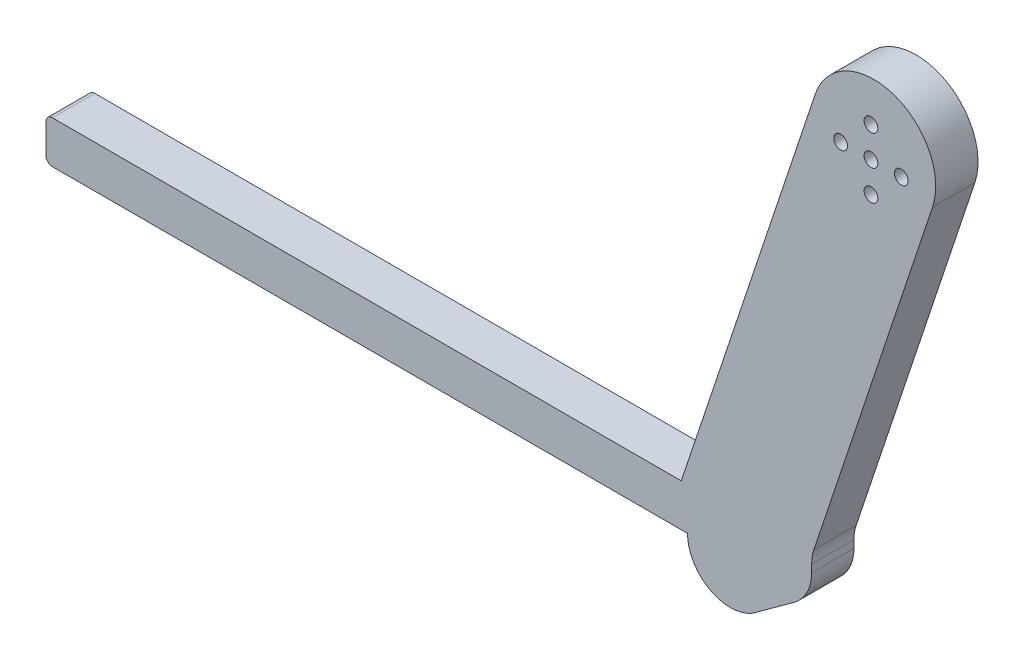
from build123d import *

# Parameters (mm, degrees)
EXTRUDE_1_DEPTH     = 10
SKETCH_1_15_R       = 1.62
CUT_EXTRUDE_2_DEPTH = 10
SKETCH_1_16_R       = 9.8
CUT_EXTRUDE_3_DEPTH = 2.2


with BuildPart() as part:
    # 草图1 → 凸台-拉伸1 (new body)
    with BuildSketch(Plane.XY):
        with BuildLine():
            Line((-150, -1.5), (-150, -8.5))
            ThreePointArc((-150, -8.5), (-149.560660172, -9.560660172), (-148.5, -10))
            Line((-148.5, -10), (1.474010293, -10))
            ThreePointArc((1.474010293, -10), (7.366779588, -19.192759664), (18.180300258, -17.676405182))
            Line((18.180300258, -17.676405182), (26.670550932, -11.495316766))
            ThreePointArc((26.670550932, -11.495316766), (29.697133836, -7.946431766), (30.784873277, -3.410837899))
            Line((30.784873277, -3.410837899), (30.784873277, -1.622776602))
            ThreePointArc((30.784873277, -1.622776602), (30.9139987, -0.020954172), (31.298040296, 1.539501058))
            Line((31.298040296, 1.539501058), (59.329162551, 85.632867822))
            ThreePointArc((59.329162551, 85.632867822), (50.093700568, 104.103791788), (31.622776602, 94.868329805))
            Line((31.622776602, 94.868329805), (0, 0))
            Line((0, 0), (-148.5, 0))
            ThreePointArc((-148.5, 0), (-149.560660172, -0.439339828), (-150, -1.5))
        make_face()
    extrude(amount=EXTRUDE_1_DEPTH)

    # 草图1<15> → 切除-拉伸2 (cut)
    with BuildSketch(Plane.XY):
        with Locations((44.787529943, 88.101420291)):
            Circle(SKETCH_1_15_R)
        with Locations((51.946529943, 88.101420291)):
            Circle(SKETCH_1_15_R)
        with Locations((44.787529943, 95.260420291)):
            Circle(SKETCH_1_15_R)
        with Locations((44.787529943, 80.942420291)):
            Circle(SKETCH_1_15_R)
        with Locations((37.628529943, 88.101420291)):
            Circle(SKETCH_1_15_R)
    extrude(amount=CUT_EXTRUDE_2_DEPTH, mode=Mode.SUBTRACT)

    # 草图1<16> → 切除-拉伸3 (cut)
    with BuildSketch(Plane.XY):
        with Locations((44.787529943, 88.101420291)):
            Circle(SKETCH_1_16_R)
    extrude(amount=CUT_EXTRUDE_3_DEPTH, mode=Mode.SUBTRACT)


solid = part.part
